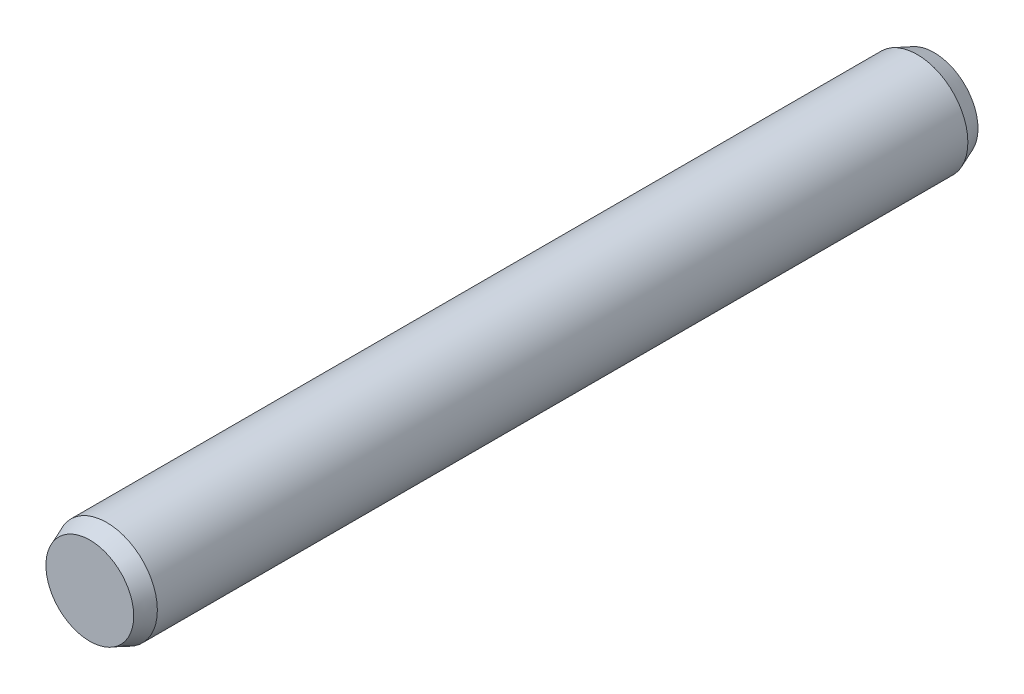
from build123d import *

# Parameters (mm, degrees)
SKETCH1_R           = 1.5
BOSS_EXTRUDE1_DEPTH = 12.5
CHAMFER1_SIZE       = 0.5
CHAMFER1_SIZE2      = 0.2
CHAMFER2_SIZE       = 0.2
CHAMFER2_SIZE2      = 0.5


with BuildPart() as part:
    # Sketch1 → Boss-Extrude1 (new, symmetric)
    with BuildSketch(Plane.XY):
        Circle(SKETCH1_R)
    extrude(amount=BOSS_EXTRUDE1_DEPTH, both=True)

    # Chamfer1
    chamfer1_edges = [part.edges().sort_by_distance(p)[0] for p in [
        (-1.5, 0, 12.5),
    ]]
    chamfer1_side = [part.faces().sort_by_distance(p)[0] for p in [
        (-1.5, 0, 0),
    ]]
    chamfer(chamfer1_edges, length=CHAMFER1_SIZE, length2=CHAMFER1_SIZE2, reference=chamfer1_side[0])

    # Chamfer2
    chamfer2_edges = [part.edges().sort_by_distance(p)[0] for p in [
        (-1.5, 0, -12.5),
    ]]
    chamfer2_side = [part.faces().sort_by_distance(p)[0] for p in [
        (0, 0, -12.5),
    ]]
    chamfer(chamfer2_edges, length=CHAMFER2_SIZE, length2=CHAMFER2_SIZE2, reference=chamfer2_side[0])


solid = part.part
